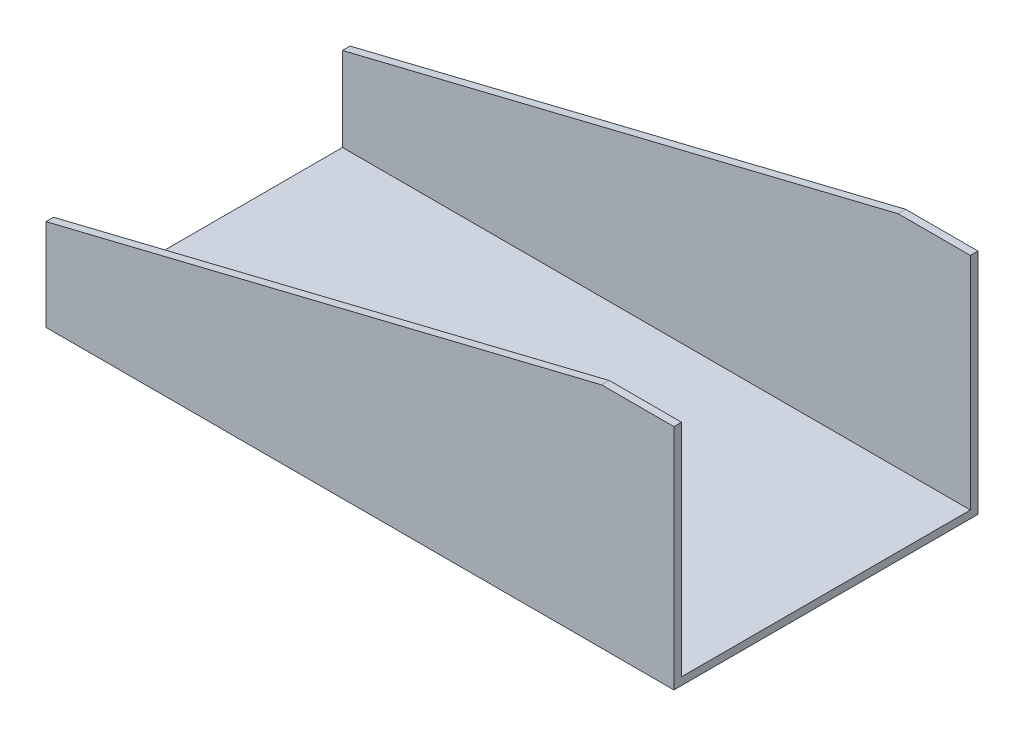
from build123d import *

# Parameters (mm, degrees)
SKETCH1_W           = 104.902
SKETCH1_H           = 48.26
BOSS_EXTRUDE1_DEPTH = 1.27
SKETCH1_3_W         = 104.902
SKETCH1_3_H         = 1.27
BOSS_EXTRUDE2_DEPTH = 38.1
CUT_EXTRUDE1_DEPTH  = 53.34


with BuildPart() as part:
    # Sketch1 → Boss-Extrude1 (new body)
    with BuildSketch(Plane(origin=(0, 0, 0), x_dir=(1, 0, 0), z_dir=(0, 1, 0))):
        with Locations((3.8862, -0.511112371)):
            Rectangle(SKETCH1_W, SKETCH1_H)
    extrude(amount=BOSS_EXTRUDE1_DEPTH)

    # Sketch1<3> → Boss-Extrude2 (add)
    with BuildSketch(Plane(origin=(0, 0, 0), x_dir=(1, 0, 0), z_dir=(0, 1, 0))):
        with Locations((3.8862, -25.276112371)):
            Rectangle(SKETCH1_3_W, SKETCH1_3_H)
        with Locations((3.8862, 24.253887629)):
            Rectangle(SKETCH1_3_W, SKETCH1_3_H)
    extrude(amount=BOSS_EXTRUDE2_DEPTH)

    # Sketch2 → Cut-Extrude1 (cut)
    with BuildSketch(Plane.XY.offset(25.911112371)):
        Polygon((-48.5648, 15.307256031), (44.262468269, 38.1), (-48.5648, 38.1), align=None)
    extrude(amount=-CUT_EXTRUDE1_DEPTH, mode=Mode.SUBTRACT)


solid = part.part
